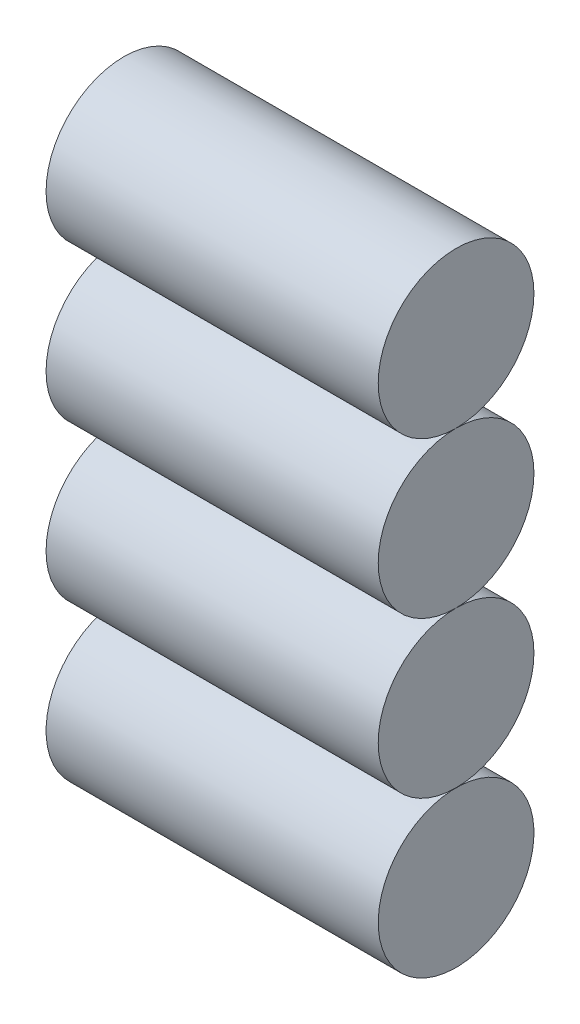
from build123d import *

# Parameters (mm, degrees)
SKETCH2_W           = 72
SKETCH2_H           = 35
BOSS_EXTRUDE1_DEPTH = 135
CUT_EXTRUDE1_DEPTH  = 135


with BuildPart() as part:
    # Sketch2 → Boss-Extrude1 (new body)
    with BuildSketch(Plane(origin=(0, 0, 0), x_dir=(1, 0, 0), z_dir=(0, 1, 0))):
        Rectangle(SKETCH2_W, SKETCH2_H)
    extrude(amount=BOSS_EXTRUDE1_DEPTH)

    # Sketch3 → Cut-Extrude1 (cut)
    with BuildSketch(Plane.ZY.offset(36)):
        with BuildLine():
            ThreePointArc((-0.623559533, 101.247119066), (-12.55700503, 106.190114037), (-17.5, 118.123559533))
            Line((-17.5, 118.123559533), (-17.5, 84.370678599))
            ThreePointArc((-17.5, 84.370678599), (-12.55700503, 96.304124096), (-0.623559533, 101.247119066))
        make_face()
        with BuildLine():
            Line((-0.623559437, 135), (-17.5, 135))
            Line((-17.5, 135), (-17.5, 118.123559533))
            ThreePointArc((-17.5, 118.123559533), (-12.557004996, 130.057005063), (-0.623559437, 135))
        make_face()
        with BuildLine():
            Line((17.5, 135), (-0.623559437, 135))
            ThreePointArc((-0.623559437, 135), (11.309885997, 130.057004996), (16.252880934, 118.123559533))
            ThreePointArc((16.252880934, 118.123559533), (11.309885963, 106.190114037), (-0.623559533, 101.247119066))
            ThreePointArc((-0.623559533, 101.247119066), (11.309885963, 96.304124096), (16.252880934, 84.370678599))
            ThreePointArc((16.252880934, 84.370678599), (11.309885963, 72.437233103), (-0.623559533, 67.494238132))
            ThreePointArc((-0.623559533, 67.494238132), (11.309885963, 62.551243162), (16.252880934, 50.617797665))
            ThreePointArc((16.252880934, 50.617797665), (11.30988595, 38.684352155), (-0.623559572, 33.741357198))
            ThreePointArc((-0.623559572, 33.741357198), (11.30988595, 28.798362241), (16.252880934, 16.864916731))
            ThreePointArc((16.252880934, 16.864916731), (11.528347893, 5.154007768), (0, 0))
            Line((0, 0), (17.5, 0))
            Line((17.5, 0), (17.5, 135))
        make_face()
        with BuildLine():
            ThreePointArc((-0.623559533, 67.494238132), (-12.55700503, 72.437233103), (-17.5, 84.370678599))
            Line((-17.5, 84.370678599), (-17.5, 50.617797777))
            ThreePointArc((-17.5, 50.617797777), (-12.55700499, 62.551243201), (-0.623559533, 67.494238132))
        make_face()
        with BuildLine():
            ThreePointArc((-0.623559572, 33.741357198), (-12.557005083, 38.684352222), (-17.5, 50.617797777))
            Line((-17.5, 50.617797777), (-17.5, 16.864916675))
            ThreePointArc((-17.5, 16.864916675), (-12.557005063, 28.798362194), (-0.623559572, 33.741357198))
        make_face()
        with BuildLine():
            ThreePointArc((-1.247119066, 0), (-12.775466939, 5.154007747), (-17.5, 16.864916675))
            Line((-17.5, 16.864916675), (-17.5, 0))
            Line((-17.5, 0), (-1.247119066, 0))
        make_face()
    extrude(amount=-CUT_EXTRUDE1_DEPTH, mode=Mode.SUBTRACT)


solid = part.part
